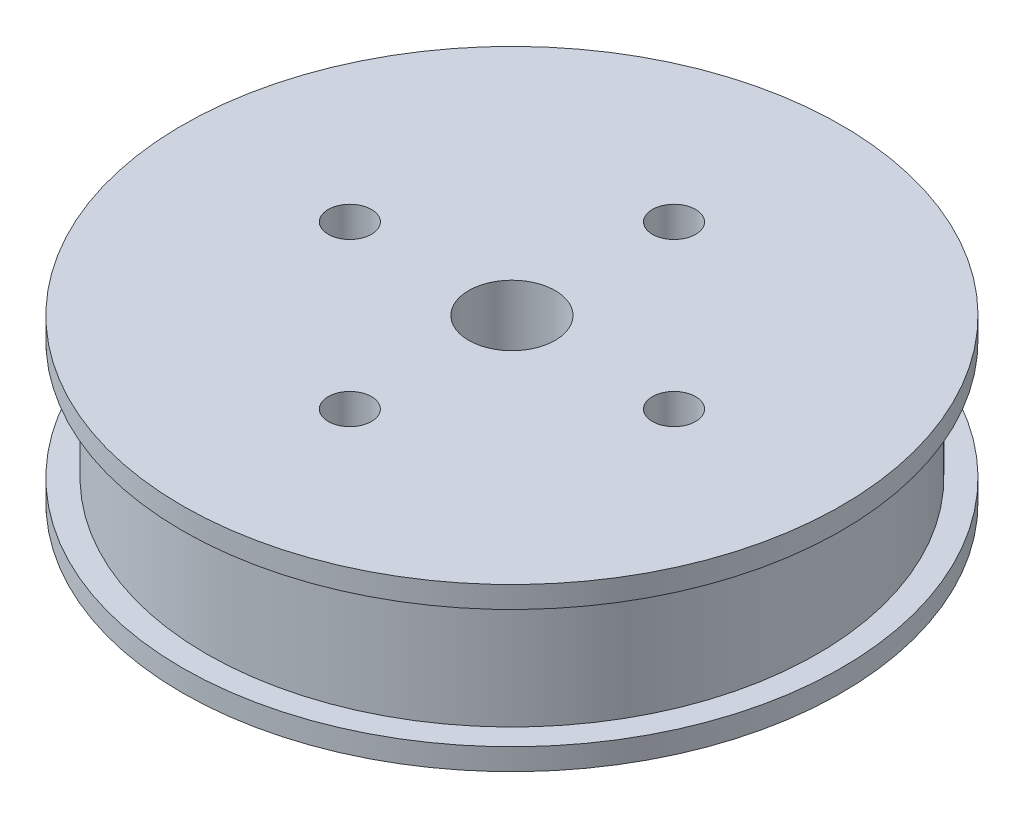
from build123d import *

# Parameters (mm, degrees)
SKETCH_1_R          = 30.5
SKETCH_1_R_2        = 4
SKETCH_1_R_3        = 2
EXTRUDE_1_DEPTH     = 15
CUT_EXTRUDE_START   = 2
SKETCH_2_R          = 30.5
SKETCH_2_R_2        = 28.265
CUT_EXTRUDE_1_DEPTH = 11


with BuildPart() as part:
    # 草图1 → 凸台-拉伸1 (new body)
    with BuildSketch(Plane(origin=(0, 0, 0), x_dir=(1, 0, 0), z_dir=(0, 1, 0))):
        with Locations(Location((0, 0, 0), (0, 0, 270))):
            Circle(SKETCH_1_R)
        with Locations(Location((0, 0, 0), (0, 0, 270))):
            Circle(SKETCH_1_R_2, mode=Mode.SUBTRACT)
        with Locations(Location((0, 15, 0), (0, 0, 270))):
            Circle(SKETCH_1_R_3, mode=Mode.SUBTRACT)
        with Locations(Location((15, 0, 0), (0, 0, 270))):
            Circle(SKETCH_1_R_3, mode=Mode.SUBTRACT)
        with Locations(Location((0, -15, 0), (0, 0, 270))):
            Circle(SKETCH_1_R_3, mode=Mode.SUBTRACT)
        with Locations(Location((-15, 0, 0), (0, 0, 270))):
            Circle(SKETCH_1_R_3, mode=Mode.SUBTRACT)
    extrude(amount=EXTRUDE_1_DEPTH)

    # 草图2 → 切除-拉伸1 (cut)
    with BuildSketch(Plane(origin=(0, 0, 0), x_dir=(1, 0, 0), z_dir=(0, 1, 0)).offset(CUT_EXTRUDE_START)):
        with Locations(Location((0, 0, 0), (0, 0, 270))):
            Circle(SKETCH_2_R)
        with Locations(Location((0, 0, 0), (0, 0, 270))):
            Circle(SKETCH_2_R_2, mode=Mode.SUBTRACT)
    extrude(amount=CUT_EXTRUDE_1_DEPTH, mode=Mode.SUBTRACT)


solid = part.part
